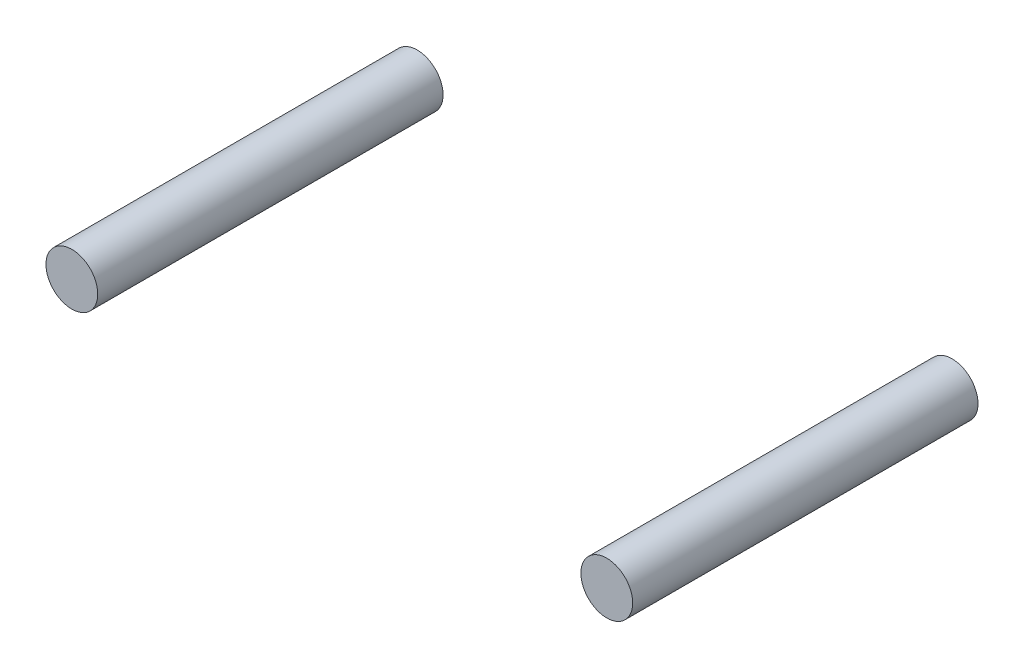
from build123d import *

# Parameters (mm, degrees)
SKETCH1_R             = 0.075
BOSS_EXTRUDE1_DEPTH   = 0.5
BOSS_EXTRUDE1_2_DEPTH = 0.5


with BuildPart() as part:
    # Sketch1 → Boss-Extrude1 (new, symmetric)
    with BuildSketch(Plane.XY):
        with Locations((-0.774525591, 10.431869079)):
            Circle(SKETCH1_R)
    extrude(amount=BOSS_EXTRUDE1_DEPTH, both=True)


with BuildPart() as body_2:
    # Sketch1 → Boss-Extrude1 2 (new, symmetric)
    with BuildSketch(Plane.XY):
        with Locations((0.774525591, 10.431869079)):
            Circle(SKETCH1_R)
    extrude(amount=BOSS_EXTRUDE1_2_DEPTH, both=True)


solid = Compound([part.part, body_2.part])
